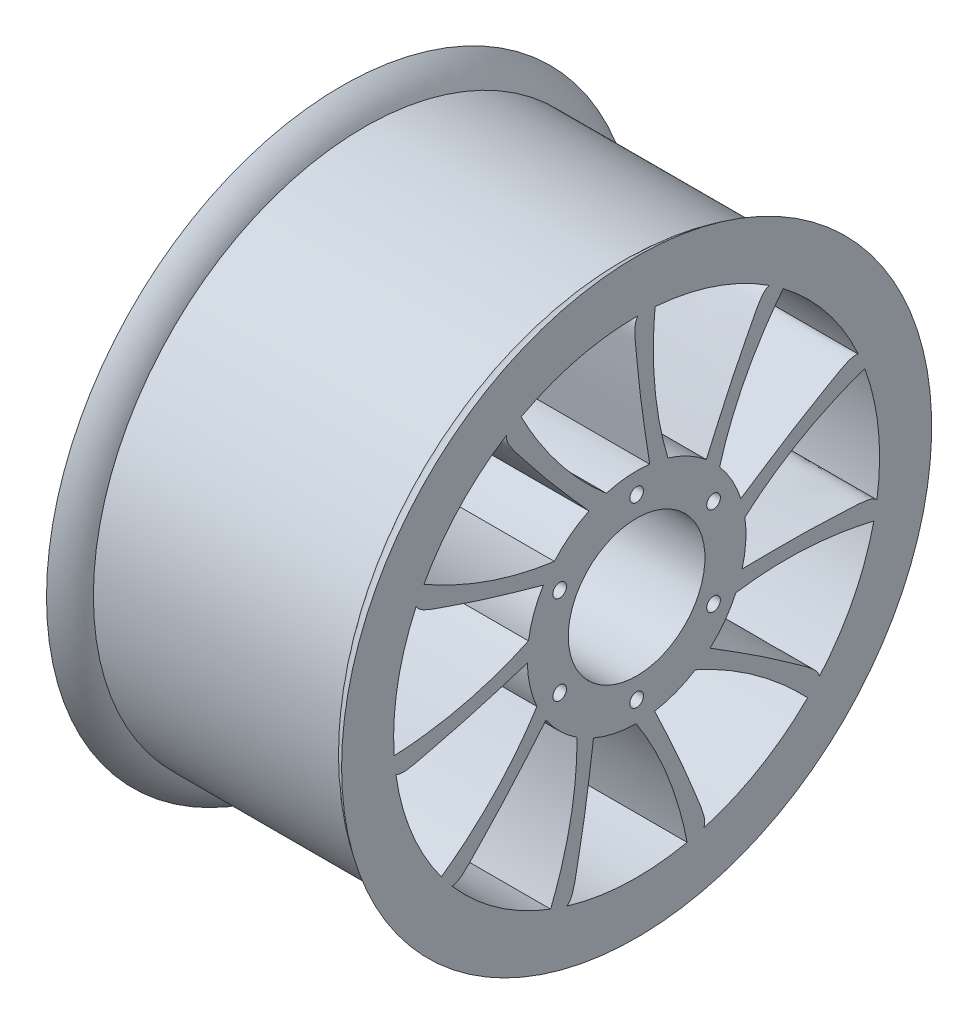
from build123d import *

# Parameters (mm, degrees)
SKETCH4_R           = 80
SKETCH4_R_2         = 50
EXTRUDE_THIN3_DEPTH = 215.9
BOSS_EXTRUDE5_DEPTH = 215.9
SKETCH7_R           = 5
CUT_EXTRUDE1_DEPTH  = 374.949769527


with BuildPart() as part:
    # Sketch1 → Revolve2 (revolve)
    with BuildSketch(Plane.XY, mode=Mode.PRIVATE) as revolve2_sk:
        with BuildLine():
            add(Edge.make_bspline(
                [(-91.389791645, 198.157117378), (-87.737723978, 189.172063745), (-89.958333333, 177.8)],
                knots=[0.538920679, 0.538920679, 0.538920679, 1, 1, 1], degree=2))
            Line((-89.958333333, 177.8), (89.958333333, 177.8))
            add(Edge.make_bspline(
                [(91.389791645, 198.157117378), (87.737723978, 189.172063745), (89.958333333, 177.8)],
                knots=[0.538920679, 0.538920679, 0.538920679, 1, 1, 1], degree=2))
            Line((91.389791645, 198.157117378), (-91.389791645, 198.157117378))
        make_face()
        with BuildLine():
            add(Edge.make_bspline(
                [(-107.95, 215.9), (-85.142221979, 202.464007291), (-89.958333333, 177.8)],
                knots=[0, 0, 0, 1, 1, 1], degree=2))
            Line((-89.958333333, 177.8), (-107.95, 177.8))
            Line((-107.95, 177.8), (-107.95, 215.9))
        make_face()
        with BuildLine():
            Line((107.95, 215.9), (107.95, 177.8))
            Line((107.95, 177.8), (89.958333333, 177.8))
            add(Edge.make_bspline(
                [(107.95, 215.9), (85.142221979, 202.464007291), (89.958333333, 177.8)],
                knots=[0, 0, 0, 1, 1, 1], degree=2))
        make_face()
    revolve(revolve2_sk.sketch.rotate(Axis((0, 0, 0), (1, 0, 0)), 90), axis=Axis((0, 0, 0), (1, 0, 0)))



with BuildPart() as body_2:
    # Sketch4 → Extrude-Thin3 (new, through all)
    with BuildSketch(Plane.ZY.offset(107.95)):
        Circle(SKETCH4_R)
        Circle(SKETCH4_R_2, mode=Mode.SUBTRACT)
    extrude(amount=-EXTRUDE_THIN3_DEPTH)


with BuildPart() as part_1:
    add(part.part)

    add(body_2.part)  # Boss-Extrude5 merges body 2
    # Sketch5 → Boss-Extrude5 (add, through all)
    with BuildSketch(Plane.ZY.offset(107.95)):
        with BuildLine():
            add(Edge.make_bspline(
                [(84.466613731, 156.455204978), (103.265760756, 154.155986618), (86.563054422, 133.698232311), (61.815758586, 101.70440423), (37.155549156, 74.715687445), (20.962946955, 56.218812287)],
                knots=[0, 0, 0, 0, 0.24250624, 0.41767252, 1, 1, 1, 1], degree=3))
            add(Edge.make_bspline(
                [(0, 60), (11.003820956, 59.93238473), (20.962946955, 56.218812287)],
                knots=[0, 0, 0, 0.88641076, 0.88641076, 0.88641076], degree=2))
            add(Edge.make_bspline(
                [(0, 60), (53.338766253, 96.187425341), (84.466613731, 156.455204978)],
                knots=[0, 0, 0, 1, 1, 1], degree=2))
        make_face()
        with BuildLine():
            add(Edge.make_bspline(
                [(155.643907122, 85.952394823), (170.215704677, 73.854583039), (145.104196955, 65.674589761), (106.988277537, 52.13906711), (71.651587329, 42.767029552), (48.029337815, 35.96084967)],
                knots=[0, 0, 0, 0, 0.24250624, 0.41767252, 1, 1, 1, 1], degree=3))
            add(Edge.make_bspline(
                [(32.438449047, 50.47521197), (41.658896726, 44.469215628), (48.029337815, 35.96084967)],
                knots=[0, 0, 0, 0.88641076, 0.88641076, 0.88641076], degree=2))
            add(Edge.make_bspline(
                [(32.438449047, 50.47521197), (96.874273812, 52.080897193), (155.643907122, 85.952394823)],
                knots=[0, 0, 0, 1, 1, 1], degree=2))
        make_face()
        with BuildLine():
            add(Edge.make_bspline(
                [(177.405359729, -11.839693378), (183.123365051, -29.895128823), (157.575782211, -23.200271004), (118.192774313, -13.980055421), (83.398752791, -2.759858046), (59.846753279, 4.28557137)],
                knots=[0, 0, 0, 0, 0.24250624, 0.41767252, 1, 1, 1, 1], degree=3))
            add(Edge.make_bspline(
                [(54.577919721, 24.92490078), (59.087567133, 14.887384769), (59.846753279, 4.28557137)],
                knots=[0, 0, 0, 0.88641076, 0.88641076, 0.88641076], degree=2))
            add(Edge.make_bspline(
                [(54.577919721, 24.92490078), (109.652883917, -8.560947828), (177.405359729, -11.839693378)],
                knots=[0, 0, 0, 1, 1, 1], degree=2))
        make_face()
        with BuildLine():
            add(Edge.make_bspline(
                [(142.841864109, -105.872762587), (137.890650908, -124.153348513), (120.018169993, -104.709209651), (91.871900355, -75.660609134), (68.667403509, -47.410510215), (52.663247433, -28.750345559)],
                knots=[0, 0, 0, 0, 0.24250624, 0.41767252, 1, 1, 1, 1], degree=3))
            add(Edge.make_bspline(
                [(59.389286513, -8.538890296), (57.756352469, -19.421085565), (52.663247433, -28.750345559)],
                knots=[0, 0, 0, 0.88641076, 0.88641076, 0.88641076], degree=2))
            add(Edge.make_bspline(
                [(59.389286513, -8.538890296), (87.617478149, -66.484752402), (142.841864109, -105.872762587)],
                knots=[0, 0, 0, 1, 1, 1], degree=2))
        make_face()
        with BuildLine():
            add(Edge.make_bspline(
                [(-173.55482323, -38.620762988), (-184.128013151, -22.907647802), (-157.729127513, -22.133731004), (-117.343773244, -19.88498756), (-80.798059175, -20.848079458), (-56.215154285, -20.972754438)],
                knots=[0, 0, 0, 0, 0.24250624, 0.41767252, 1, 1, 1, 1], degree=3))
            add(Edge.make_bspline(
                [(-45.344974461, -39.291644037), (-52.499844517, -30.931232448), (-56.215154285, -20.972754438)],
                knots=[0, 0, 0, 0.88641076, 0.88641076, 0.88641076], degree=2))
            add(Edge.make_bspline(
                [(-45.344974461, -39.291644037), (-107.623069376, -22.678618063), (-173.55482323, -38.620762988)],
                knots=[0, 0, 0, 1, 1, 1], degree=2))
        make_face()
        with BuildLine():
            add(Edge.make_bspline(
                [(-166.883569054, 61.3409682), (-167.28315099, 80.275979904), (-144.656584174, 66.654725033), (-109.466499727, 46.712517455), (-79.242975447, 26.144208264), (-58.629924244, 12.748803202)],
                knots=[0, 0, 0, 0, 0.24250624, 0.41767252, 1, 1, 1, 1], degree=3))
            add(Edge.make_bspline(
                [(-59.389286513, -8.538890296), (-60.888366468, 2.362550284), (-58.629924244, 12.748803202)],
                knots=[0, 0, 0, 0.88641076, 0.88641076, 0.88641076], degree=2))
            add(Edge.make_bspline(
                [(-59.389286513, -8.538890296), (-102.799273935, 39.106956639), (-166.883569054, 61.3409682)],
                knots=[0, 0, 0, 1, 1, 1], degree=2))
        make_face()
        with BuildLine():
            add(Edge.make_bspline(
                [(-107.227960847, 141.827375399), (-97.327070356, 157.972551194), (-85.656597455, 134.280776832), (-66.834386, 98.479128232), (-52.528806919, 64.835894589), (-42.430107516, 42.422705904)],
                knots=[0, 0, 0, 0, 0.24250624, 0.41767252, 1, 1, 1, 1], degree=3))
            add(Edge.make_bspline(
                [(-54.577919721, 24.92490078), (-49.945262283, 34.906239994), (-42.430107516, 42.422705904)],
                knots=[0, 0, 0, 0.88641076, 0.88641076, 0.88641076], degree=2))
            add(Edge.make_bspline(
                [(-54.577919721, 24.92490078), (-65.337435364, 88.476348925), (-107.227960847, 141.827375399)],
                knots=[0, 0, 0, 1, 1, 1], degree=2))
        make_face()
        with BuildLine():
            add(Edge.make_bspline(
                [(-13.528232707, 177.284593013), (3.529667435, 185.51395366), (0.538753736, 159.27363077), (-2.982826947, 118.979311617), (-9.137113345, 82.94264249), (-12.759031447, 58.627699226)],
                knots=[0, 0, 0, 0, 0.24250624, 0.41767252, 1, 1, 1, 1], degree=3))
            add(Edge.make_bspline(
                [(-32.438449047, 50.47521197), (-23.144890219, 56.367445141), (-12.759031447, 58.627699226)],
                knots=[0, 0, 0, 0.88641076, 0.88641076, 0.88641076], degree=2))
            add(Edge.make_bspline(
                [(-32.438449047, 50.47521197), (-7.131422718, 109.755125571), (-13.528232707, 177.284593013)],
                knots=[0, 0, 0, 1, 1, 1], degree=2))
        make_face()
        with BuildLine():
            add(Edge.make_bspline(
                [(62.927085906, -166.291977736), (48.878629391, -178.993757276), (44.35563681, -152.973714073), (36.38234717, -113.319454039), (32.134638794, -77.008660377), (28.759532628, -52.658230914)],
                knots=[0, 0, 0, 0, 0.24250624, 0.41767252, 1, 1, 1, 1], degree=3))
            add(Edge.make_bspline(
                [(45.344974461, -39.291644037), (38.087903982, -47.563498455), (28.759532628, -52.658230914)],
                knots=[0, 0, 0, 0.88641076, 0.88641076, 0.88641076], degree=2))
            add(Edge.make_bspline(
                [(45.344974461, -39.291644037), (37.764142143, -103.300117847), (62.927085906, -166.291977736)],
                knots=[0, 0, 0, 1, 1, 1], degree=2))
        make_face()
        with BuildLine():
            add(Edge.make_bspline(
                [(-36.96659745, -173.914664916), (-55.652011598, -177.004912813), (-45.389497658, -152.670145138), (-30.658344176, -115.000172964), (-14.600646686, -82.157104987), (-4.275130581, -59.847500019)],
                knots=[0, 0, 0, 0, 0.24250624, 0.41767252, 1, 1, 1, 1], degree=3))
            add(Edge.make_bspline(
                [(16.90395341, -57.569578417), (6.326815098, -60.604836653), (-4.275130581, -59.847500019)],
                knots=[0, 0, 0, 0.88641076, 0.88641076, 0.88641076], degree=2))
            add(Edge.make_bspline(
                [(16.90395341, -57.569578417), (-24.079042164, -107.31842576), (-36.96659745, -173.914664916)],
                knots=[0, 0, 0, 1, 1, 1], degree=2))
        make_face()
        with BuildLine():
            add(Edge.make_bspline(
                [(-125.123647309, -126.320674808), (-142.513532123, -118.818259189), (-120.723787327, -103.894883837), (-87.965227868, -80.169149525), (-56.700330006, -61.221249258), (-35.952470037, -48.03561073)],
                knots=[0, 0, 0, 0, 0.24250624, 0.41767252, 1, 1, 1, 1], degree=3))
            add(Edge.make_bspline(
                [(-16.90395341, -57.569578417), (-27.442992877, -54.404567427), (-35.952470037, -48.03561073)],
                knots=[0, 0, 0, 0.88641076, 0.88641076, 0.88641076], degree=2))
            add(Edge.make_bspline(
                [(-16.90395341, -57.569578417), (-78.277300718, -77.263891769), (-125.123647309, -126.320674808)],
                knots=[0, 0, 0, 1, 1, 1], degree=2))
        make_face()
    extrude(amount=-BOSS_EXTRUDE5_DEPTH)

    # Sketch7 → Cut-Extrude1 (cut, through all)
    with BuildSketch(Plane.ZY.offset(107.95)):
        with Locations((-56.291651246, 32.5)):
            Circle(SKETCH7_R)
        with Locations((0, 65)):
            Circle(SKETCH7_R)
        with Locations((56.291651246, 32.5)):
            Circle(SKETCH7_R)
        with Locations((-56.291651246, -32.5)):
            Circle(SKETCH7_R)
        with Locations((0, -65)):
            Circle(SKETCH7_R)
        with Locations((56.291651246, -32.5)):
            Circle(SKETCH7_R)
    extrude(amount=-CUT_EXTRUDE1_DEPTH, mode=Mode.SUBTRACT)


solid = part_1.part
